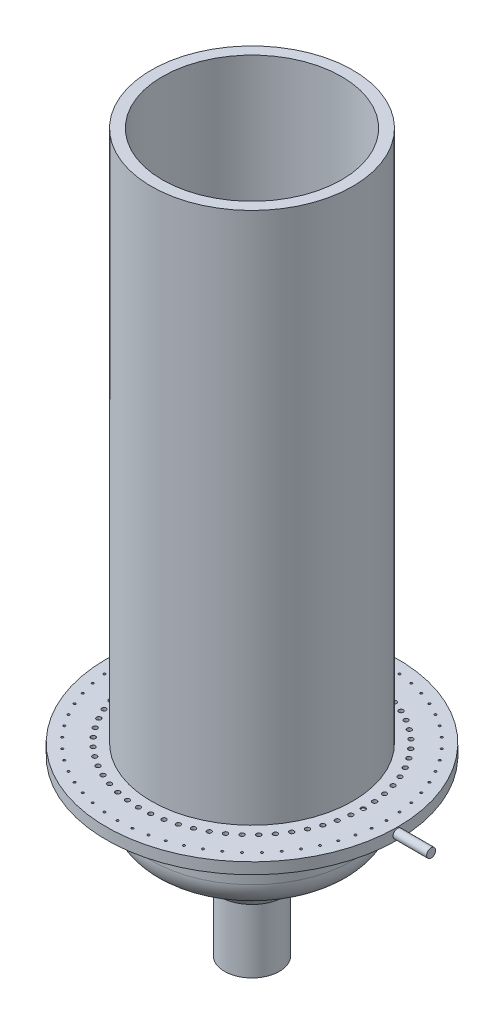
from build123d import *

# Parameters (mm, degrees)
CUT_EXTRUDE1_DEPTH      = 18
CUT_EXTRUDE1_DEPTH_BACK = 23
SKETCH4_R               = 0.5
SKETCH4_R_2             = 0.25
CUT_EXTRUDE2_DEPTH      = 10
CIRPATTERN1_COUNT       = 15
BOSS_EXTRUDE1_START     = 20
SKETCH5_R               = 1
BOSS_EXTRUDE1_DEPTH     = 20
BOSS_EXTRUDE2_START     = 2
SKETCH6_R               = 14.045084972
SKETCH6_R_2             = 13.708203932
BOSS_EXTRUDE2_DEPTH     = 2


with BuildPart() as part:
    # Sketch1 → Revolve1 (revolve)
    with BuildSketch(Plane.XY, mode=Mode.PRIVATE) as revolve1_sk:
        with BuildLine():
            Line((-20, 8.5), (-20, 80))
            Line((-20, 80), (-20, 81.381966011))
            Line((-20, 81.381966011), (-20, 136.381966011))
            Line((-20, 136.381966011), (-22.5, 136.381966011))
            Line((-22.5, 136.381966011), (-22.5, 81.381966011))
            Line((-22.5, 81.381966011), (-22.5, 17.5))
            Line((-22.5, 17.5), (-32.5, 17.5))
            Line((-32.5, 17.5), (-32.5, 15))
            Line((-32.5, 15), (-22.5, 15))
            Line((-22.5, 15), (-22.5, 6))
            ThreePointArc((-22.5, 6), (-20.742640687, 1.757359313), (-16.5, 0))
            Line((-16.5, 0), (-15.253288904, 0))
            ThreePointArc((-15.253288904, 0), (-12.098902232, -0.89609515), (-9.886725758, -3.316718427))
            Line((-9.886725758, -3.316718427), (-7.236067977, -8.618033989))
            Line((-7.236067977, -8.618033989), (-6.118033989, -8.618033989))
            Line((-6.118033989, -8.618033989), (-6.118033989, -23.618033989))
            Line((-6.118033989, -23.618033989), (-5, -23.618033989))
            Line((-5, -23.618033989), (-5, -8.618033989))
            Line((-5, -8.618033989), (-5, -7.5))
            Line((-5, -7.5), (-8.341640786, -0.816718427))
            ThreePointArc((-8.341640786, -0.816718427), (-10.55381726, 1.60390485), (-13.708203932, 2.5))
            Line((-13.708203932, 2.5), (-20, 2.5))
            Line((-20, 2.5), (-20, 8.5))
        make_face()
    revolve(revolve1_sk.sketch.rotate(Axis((0, -777.658176703, 0), (0, 1, 0)), 180), axis=Axis((0, -777.658176703, 0), (0, 1, 0)))

    # Sketch3 → Cut-Extrude1 (cut, two sides: drawn at the far end of the back side and taken through both)
    with BuildSketch(Plane.XZ.offset(-CUT_EXTRUDE1_DEPTH_BACK)):
        with BuildLine():
            Line((-18.708286934, 1.25), (-13.989349944, 1.25))
            ThreePointArc((-13.989349944, 1.25), (-9.931374826, 9.931374826), (-1.25, 13.989349944))
            Line((-1.25, 13.989349944), (-1.25, 18.708286934))
            ThreePointArc((-1.25, 18.708286934), (-13.258252147, 13.258252147), (-18.708286934, 1.25))
        make_face()
        with BuildLine():
            Line((18.708286934, 1.25), (13.989349944, 1.25))
            ThreePointArc((13.989349944, 1.25), (9.931374826, 9.931374826), (1.25, 13.989349944))
            Line((1.25, 13.989349944), (1.25, 18.708286934))
            ThreePointArc((1.25, 18.708286934), (13.258252147, 13.258252147), (18.708286934, 1.25))
        make_face()
        with BuildLine():
            Line((18.708286934, -1.25), (13.989349944, -1.25))
            ThreePointArc((13.989349944, -1.25), (9.931374826, -9.931374826), (1.25, -13.989349944))
            Line((1.25, -13.989349944), (1.25, -18.708286934))
            ThreePointArc((1.25, -18.708286934), (13.258252147, -13.258252147), (18.708286934, -1.25))
        make_face()
        with BuildLine():
            Line((-18.708286934, -1.25), (-13.989349944, -1.25))
            ThreePointArc((-13.989349944, -1.25), (-9.931374826, -9.931374826), (-1.25, -13.989349944))
            Line((-1.25, -13.989349944), (-1.25, -18.708286934))
            ThreePointArc((-1.25, -18.708286934), (-13.258252147, -13.258252147), (-18.708286934, -1.25))
        make_face()
    extrude(amount=CUT_EXTRUDE1_DEPTH + CUT_EXTRUDE1_DEPTH_BACK, mode=Mode.SUBTRACT)

    # Sketch4 → Cut-Extrude2 (cut)
    with BuildSketch(Plane.XZ.offset(-15)):
        with Locations((25, -2.378505748)):
            Circle(SKETCH4_R)
        with Locations((-30, 0)):
            Circle(SKETCH4_R_2)
        with Locations((-25, 2.378505748)):
            Circle(SKETCH4_R)
        with Locations((2.378505748, 25)):
            Circle(SKETCH4_R)
        with Locations((0, 30)):
            Circle(SKETCH4_R_2)
        with Locations((30, 0)):
            Circle(SKETCH4_R_2)
        with Locations((0, -30)):
            Circle(SKETCH4_R_2)
        with Locations((-2.378505748, -25)):
            Circle(SKETCH4_R)
    cut_extrude2 = extrude(amount=-CUT_EXTRUDE2_DEPTH, mode=Mode.SUBTRACT)

    # CirPattern1: Cut-Extrude2 ×15 about axis
    cirpattern1_axis = Axis((0, 0, 0), (0, 1, 0))
    for i in range(1, CIRPATTERN1_COUNT):
        add(cut_extrude2.rotate(cirpattern1_axis, i * 360 / CIRPATTERN1_COUNT), mode=Mode.SUBTRACT)

    # Sketch5 → Boss-Extrude1 (add)
    with BuildSketch(Plane(origin=(0, 0, 0), x_dir=(0, 0, -1), z_dir=(1, 0, 0)).offset(BOSS_EXTRUDE1_START)):
        with Locations(Location((0, 16.25, 0), (0, 0, 270))):
            Circle(SKETCH5_R)
    extrude(amount=BOSS_EXTRUDE1_DEPTH)

    # Sketch6 → Boss-Extrude2 (add)
    with BuildSketch(Plane(origin=(0, 2.5, 0), x_dir=(1, 0, 0), z_dir=(0, 1, 0)).offset(BOSS_EXTRUDE2_START)):
        with Locations(Location((0, 0, 0), (0, 0, 180))):
            Circle(SKETCH6_R)
        Circle(SKETCH6_R_2, mode=Mode.SUBTRACT)
    extrude(amount=-BOSS_EXTRUDE2_DEPTH)


solid = part.part
